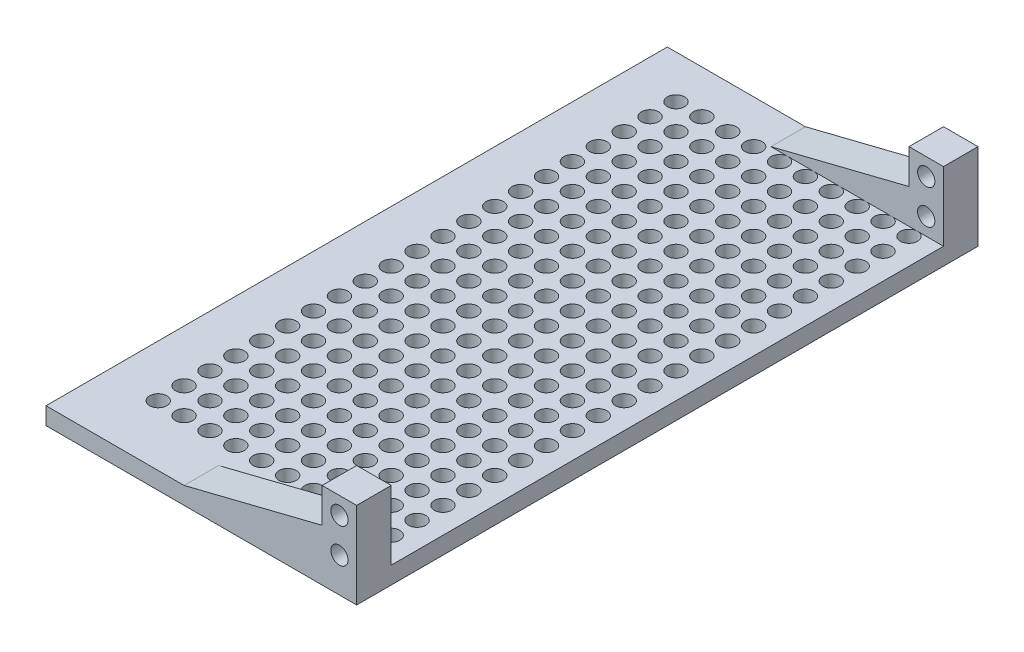
from build123d import *

# Parameters (mm, degrees)
ESQUISSE1_W             = 90
ESQUISSE1_H             = 5
BOSS_EXTRU_1_DEPTH      = 180
ESQUISSE2_W             = 10
ESQUISSE2_H             = 10
BOSS_EXTRU_2_DEPTH      = 20
ESQUISSE3_R             = 2.5
ENL_V_MAT_EXTRU_1_DEPTH = 10
BOSS_EXTRU_3_DEPTH      = 10
ESQUISSE5_R             = 2.5
ENL_V_MAT_EXTRU_2_DEPTH = 5


with BuildPart() as part:
    # Esquisse1 → Boss.-Extru.1 (new body)
    with BuildSketch(Plane.XY):
        Rectangle(ESQUISSE1_W, ESQUISSE1_H)
    extrude(amount=BOSS_EXTRU_1_DEPTH)

    # Esquisse2 → Boss.-Extru.2 (add)
    with BuildSketch(Plane(origin=(0, 2.5, 0), x_dir=(1, 0, 0), z_dir=(0, 1, 0))):
        with Locations((40, -5)):
            Rectangle(ESQUISSE2_W, ESQUISSE2_H)
        with Locations((40, -175)):
            Rectangle(ESQUISSE2_W, ESQUISSE2_H)
    extrude(amount=BOSS_EXTRU_2_DEPTH)

    # Esquisse3 → Enlèv. mat.-Extru.1 (cut)
    with BuildSketch(Plane.XY.offset(180)):
        with Locations((40, 17.5)):
            Circle(ESQUISSE3_R)
        with Locations((40, 7.5)):
            Circle(ESQUISSE3_R)
    enl_v_mat_extru_1 = extrude(amount=-ENL_V_MAT_EXTRU_1_DEPTH, mode=Mode.SUBTRACT)

    # Esquisse4 → Boss.-Extru.3 (add)
    with BuildSketch(Plane.XY.offset(180)):
        Polygon((35, 12.5), (-5, 2.5), (35, 2.5), align=None)
    boss_extru_3 = extrude(amount=-BOSS_EXTRU_3_DEPTH)

    # Symétrie1: Enlèv. mat.-Extru.1, Boss.-Extru.3 across plane
    add(enl_v_mat_extru_1.mirror(Plane.XY.offset(90)), mode=Mode.SUBTRACT)
    add(boss_extru_3.mirror(Plane.XY.offset(90)))

    # Esquisse5 → Enlèv. mat.-Extru.2 (cut)
    with BuildSketch(Plane(origin=(0, 2.5, 0), x_dir=(1, 0, 0), z_dir=(0, 1, 0))):
        with Locations(Location((37.5, -162.5, 0), (0, 0, 270))):
            Circle(ESQUISSE5_R)
        with Locations(Location((30, -162.5, 0), (0, 0, 270))):
            Circle(ESQUISSE5_R)
        with Locations(Location((22.5, -162.5, 0), (0, 0, 270))):
            Circle(ESQUISSE5_R)
        with Locations(Location((15, -162.5, 0), (0, 0, 270))):
            Circle(ESQUISSE5_R)
        with Locations(Location((7.5, -162.5, 0), (0, 0, 270))):
            Circle(ESQUISSE5_R)
        with Locations(Location((0, -162.5, 0), (0, 0, 270))):
            Circle(ESQUISSE5_R)
        with Locations(Location((-7.5, -162.5, 0), (0, 0, 270))):
            Circle(ESQUISSE5_R)
        with Locations(Location((-15, -162.5, 0), (0, 0, 270))):
            Circle(ESQUISSE5_R)
        with Locations(Location((-22.5, -162.5, 0), (0, 0, 270))):
            Circle(ESQUISSE5_R)
        with Locations(Location((-30, -162.5, 0), (0, 0, 270))):
            Circle(ESQUISSE5_R)
        with Locations(Location((30, -155, 0), (0, 0, 270))):
            Circle(ESQUISSE5_R)
        with Locations(Location((22.5, -155, 0), (0, 0, 270))):
            Circle(ESQUISSE5_R)
        with Locations(Location((15, -155, 0), (0, 0, 270))):
            Circle(ESQUISSE5_R)
        with Locations(Location((7.5, -155, 0), (0, 0, 270))):
            Circle(ESQUISSE5_R)
        with Locations(Location((0, -155, 0), (0, 0, 270))):
            Circle(ESQUISSE5_R)
        with Locations(Location((-7.5, -155, 0), (0, 0, 270))):
            Circle(ESQUISSE5_R)
        with Locations(Location((-15, -155, 0), (0, 0, 270))):
            Circle(ESQUISSE5_R)
        with Locations(Location((-22.5, -155, 0), (0, 0, 270))):
            Circle(ESQUISSE5_R)
        with Locations(Location((-30, -155, 0), (0, 0, 270))):
            Circle(ESQUISSE5_R)
        with Locations(Location((30, -147.5, 0), (0, 0, 270))):
            Circle(ESQUISSE5_R)
        with Locations(Location((22.5, -147.5, 0), (0, 0, 270))):
            Circle(ESQUISSE5_R)
        with Locations(Location((15, -147.5, 0), (0, 0, 270))):
            Circle(ESQUISSE5_R)
        with Locations(Location((7.5, -147.5, 0), (0, 0, 270))):
            Circle(ESQUISSE5_R)
        with Locations(Location((0, -147.5, 0), (0, 0, 270))):
            Circle(ESQUISSE5_R)
        with Locations(Location((-7.5, -147.5, 0), (0, 0, 270))):
            Circle(ESQUISSE5_R)
        with Locations(Location((-15, -147.5, 0), (0, 0, 270))):
            Circle(ESQUISSE5_R)
        with Locations(Location((-22.5, -147.5, 0), (0, 0, 270))):
            Circle(ESQUISSE5_R)
        with Locations(Location((-30, -147.5, 0), (0, 0, 270))):
            Circle(ESQUISSE5_R)
        with Locations(Location((30, -140, 0), (0, 0, 270))):
            Circle(ESQUISSE5_R)
        with Locations(Location((22.5, -140, 0), (0, 0, 270))):
            Circle(ESQUISSE5_R)
        with Locations(Location((15, -140, 0), (0, 0, 270))):
            Circle(ESQUISSE5_R)
        with Locations(Location((7.5, -140, 0), (0, 0, 270))):
            Circle(ESQUISSE5_R)
        with Locations(Location((0, -140, 0), (0, 0, 270))):
            Circle(ESQUISSE5_R)
        with Locations(Location((-7.5, -140, 0), (0, 0, 270))):
            Circle(ESQUISSE5_R)
        with Locations(Location((-15, -140, 0), (0, 0, 270))):
            Circle(ESQUISSE5_R)
        with Locations(Location((-22.5, -140, 0), (0, 0, 270))):
            Circle(ESQUISSE5_R)
        with Locations(Location((-30, -140, 0), (0, 0, 270))):
            Circle(ESQUISSE5_R)
        with Locations(Location((30, -132.5, 0), (0, 0, 270))):
            Circle(ESQUISSE5_R)
        with Locations(Location((22.5, -132.5, 0), (0, 0, 270))):
            Circle(ESQUISSE5_R)
        with Locations(Location((15, -132.5, 0), (0, 0, 270))):
            Circle(ESQUISSE5_R)
        with Locations(Location((7.5, -132.5, 0), (0, 0, 270))):
            Circle(ESQUISSE5_R)
        with Locations(Location((0, -132.5, 0), (0, 0, 270))):
            Circle(ESQUISSE5_R)
        with Locations(Location((-7.5, -132.5, 0), (0, 0, 270))):
            Circle(ESQUISSE5_R)
        with Locations(Location((-15, -132.5, 0), (0, 0, 270))):
            Circle(ESQUISSE5_R)
        with Locations(Location((-22.5, -132.5, 0), (0, 0, 270))):
            Circle(ESQUISSE5_R)
        with Locations(Location((-30, -132.5, 0), (0, 0, 270))):
            Circle(ESQUISSE5_R)
        with Locations(Location((30, -125, 0), (0, 0, 270))):
            Circle(ESQUISSE5_R)
        with Locations(Location((22.5, -125, 0), (0, 0, 270))):
            Circle(ESQUISSE5_R)
        with Locations(Location((15, -125, 0), (0, 0, 270))):
            Circle(ESQUISSE5_R)
        with Locations(Location((7.5, -125, 0), (0, 0, 270))):
            Circle(ESQUISSE5_R)
        with Locations(Location((0, -125, 0), (0, 0, 270))):
            Circle(ESQUISSE5_R)
        with Locations(Location((-7.5, -125, 0), (0, 0, 270))):
            Circle(ESQUISSE5_R)
        with Locations(Location((-15, -125, 0), (0, 0, 270))):
            Circle(ESQUISSE5_R)
        with Locations(Location((-22.5, -125, 0), (0, 0, 270))):
            Circle(ESQUISSE5_R)
        with Locations(Location((-30, -125, 0), (0, 0, 270))):
            Circle(ESQUISSE5_R)
        with Locations(Location((30, -117.5, 0), (0, 0, 270))):
            Circle(ESQUISSE5_R)
        with Locations(Location((22.5, -117.5, 0), (0, 0, 270))):
            Circle(ESQUISSE5_R)
        with Locations(Location((15, -117.5, 0), (0, 0, 270))):
            Circle(ESQUISSE5_R)
        with Locations(Location((7.5, -117.5, 0), (0, 0, 270))):
            Circle(ESQUISSE5_R)
        with Locations(Location((0, -117.5, 0), (0, 0, 270))):
            Circle(ESQUISSE5_R)
        with Locations(Location((-7.5, -117.5, 0), (0, 0, 270))):
            Circle(ESQUISSE5_R)
        with Locations(Location((-15, -117.5, 0), (0, 0, 270))):
            Circle(ESQUISSE5_R)
        with Locations(Location((-22.5, -117.5, 0), (0, 0, 270))):
            Circle(ESQUISSE5_R)
        with Locations(Location((-30, -117.5, 0), (0, 0, 270))):
            Circle(ESQUISSE5_R)
        with Locations(Location((30, -110, 0), (0, 0, 270))):
            Circle(ESQUISSE5_R)
        with Locations(Location((22.5, -110, 0), (0, 0, 270))):
            Circle(ESQUISSE5_R)
        with Locations(Location((15, -110, 0), (0, 0, 270))):
            Circle(ESQUISSE5_R)
        with Locations(Location((7.5, -110, 0), (0, 0, 270))):
            Circle(ESQUISSE5_R)
        with Locations(Location((0, -110, 0), (0, 0, 270))):
            Circle(ESQUISSE5_R)
        with Locations(Location((-7.5, -110, 0), (0, 0, 270))):
            Circle(ESQUISSE5_R)
        with Locations(Location((-15, -110, 0), (0, 0, 270))):
            Circle(ESQUISSE5_R)
        with Locations(Location((-22.5, -110, 0), (0, 0, 270))):
            Circle(ESQUISSE5_R)
        with Locations(Location((-30, -110, 0), (0, 0, 270))):
            Circle(ESQUISSE5_R)
        with Locations(Location((30, -102.5, 0), (0, 0, 270))):
            Circle(ESQUISSE5_R)
        with Locations(Location((22.5, -102.5, 0), (0, 0, 270))):
            Circle(ESQUISSE5_R)
        with Locations(Location((15, -102.5, 0), (0, 0, 270))):
            Circle(ESQUISSE5_R)
        with Locations(Location((7.5, -102.5, 0), (0, 0, 270))):
            Circle(ESQUISSE5_R)
        with Locations(Location((0, -102.5, 0), (0, 0, 270))):
            Circle(ESQUISSE5_R)
        with Locations(Location((-7.5, -102.5, 0), (0, 0, 270))):
            Circle(ESQUISSE5_R)
        with Locations(Location((-15, -102.5, 0), (0, 0, 270))):
            Circle(ESQUISSE5_R)
        with Locations(Location((-22.5, -102.5, 0), (0, 0, 270))):
            Circle(ESQUISSE5_R)
        with Locations(Location((-30, -102.5, 0), (0, 0, 270))):
            Circle(ESQUISSE5_R)
        with Locations(Location((30, -95, 0), (0, 0, 270))):
            Circle(ESQUISSE5_R)
        with Locations(Location((22.5, -95, 0), (0, 0, 270))):
            Circle(ESQUISSE5_R)
        with Locations(Location((15, -95, 0), (0, 0, 270))):
            Circle(ESQUISSE5_R)
        with Locations(Location((7.5, -95, 0), (0, 0, 270))):
            Circle(ESQUISSE5_R)
        with Locations(Location((0, -95, 0), (0, 0, 270))):
            Circle(ESQUISSE5_R)
        with Locations(Location((-7.5, -95, 0), (0, 0, 270))):
            Circle(ESQUISSE5_R)
        with Locations(Location((-15, -95, 0), (0, 0, 270))):
            Circle(ESQUISSE5_R)
        with Locations(Location((-22.5, -95, 0), (0, 0, 270))):
            Circle(ESQUISSE5_R)
        with Locations(Location((-30, -95, 0), (0, 0, 270))):
            Circle(ESQUISSE5_R)
        with Locations(Location((30, -87.5, 0), (0, 0, 270))):
            Circle(ESQUISSE5_R)
        with Locations(Location((22.5, -87.5, 0), (0, 0, 270))):
            Circle(ESQUISSE5_R)
        with Locations(Location((15, -87.5, 0), (0, 0, 270))):
            Circle(ESQUISSE5_R)
        with Locations(Location((7.5, -87.5, 0), (0, 0, 270))):
            Circle(ESQUISSE5_R)
        with Locations(Location((0, -87.5, 0), (0, 0, 270))):
            Circle(ESQUISSE5_R)
        with Locations(Location((-7.5, -87.5, 0), (0, 0, 270))):
            Circle(ESQUISSE5_R)
        with Locations(Location((-15, -87.5, 0), (0, 0, 270))):
            Circle(ESQUISSE5_R)
        with Locations(Location((-22.5, -87.5, 0), (0, 0, 270))):
            Circle(ESQUISSE5_R)
        with Locations(Location((-30, -87.5, 0), (0, 0, 270))):
            Circle(ESQUISSE5_R)
        with Locations(Location((30, -80, 0), (0, 0, 270))):
            Circle(ESQUISSE5_R)
        with Locations(Location((22.5, -80, 0), (0, 0, 270))):
            Circle(ESQUISSE5_R)
        with Locations(Location((15, -80, 0), (0, 0, 270))):
            Circle(ESQUISSE5_R)
        with Locations(Location((7.5, -80, 0), (0, 0, 270))):
            Circle(ESQUISSE5_R)
        with Locations(Location((0, -80, 0), (0, 0, 270))):
            Circle(ESQUISSE5_R)
        with Locations(Location((-7.5, -80, 0), (0, 0, 270))):
            Circle(ESQUISSE5_R)
        with Locations(Location((-15, -80, 0), (0, 0, 270))):
            Circle(ESQUISSE5_R)
        with Locations(Location((-22.5, -80, 0), (0, 0, 270))):
            Circle(ESQUISSE5_R)
        with Locations(Location((-30, -80, 0), (0, 0, 270))):
            Circle(ESQUISSE5_R)
        with Locations(Location((30, -72.5, 0), (0, 0, 270))):
            Circle(ESQUISSE5_R)
        with Locations(Location((22.5, -72.5, 0), (0, 0, 270))):
            Circle(ESQUISSE5_R)
        with Locations(Location((15, -72.5, 0), (0, 0, 270))):
            Circle(ESQUISSE5_R)
        with Locations(Location((7.5, -72.5, 0), (0, 0, 270))):
            Circle(ESQUISSE5_R)
        with Locations(Location((0, -72.5, 0), (0, 0, 270))):
            Circle(ESQUISSE5_R)
        with Locations(Location((-7.5, -72.5, 0), (0, 0, 270))):
            Circle(ESQUISSE5_R)
        with Locations(Location((-15, -72.5, 0), (0, 0, 270))):
            Circle(ESQUISSE5_R)
        with Locations(Location((-22.5, -72.5, 0), (0, 0, 270))):
            Circle(ESQUISSE5_R)
        with Locations(Location((-30, -72.5, 0), (0, 0, 270))):
            Circle(ESQUISSE5_R)
        with Locations(Location((30, -65, 0), (0, 0, 270))):
            Circle(ESQUISSE5_R)
        with Locations(Location((22.5, -65, 0), (0, 0, 270))):
            Circle(ESQUISSE5_R)
        with Locations(Location((15, -65, 0), (0, 0, 270))):
            Circle(ESQUISSE5_R)
        with Locations(Location((7.5, -65, 0), (0, 0, 270))):
            Circle(ESQUISSE5_R)
        with Locations(Location((0, -65, 0), (0, 0, 270))):
            Circle(ESQUISSE5_R)
        with Locations(Location((-7.5, -65, 0), (0, 0, 270))):
            Circle(ESQUISSE5_R)
        with Locations(Location((-15, -65, 0), (0, 0, 270))):
            Circle(ESQUISSE5_R)
        with Locations(Location((-22.5, -65, 0), (0, 0, 270))):
            Circle(ESQUISSE5_R)
        with Locations(Location((-30, -65, 0), (0, 0, 270))):
            Circle(ESQUISSE5_R)
        with Locations(Location((30, -57.5, 0), (0, 0, 270))):
            Circle(ESQUISSE5_R)
        with Locations(Location((22.5, -57.5, 0), (0, 0, 270))):
            Circle(ESQUISSE5_R)
        with Locations(Location((15, -57.5, 0), (0, 0, 270))):
            Circle(ESQUISSE5_R)
        with Locations(Location((7.5, -57.5, 0), (0, 0, 270))):
            Circle(ESQUISSE5_R)
        with Locations(Location((0, -57.5, 0), (0, 0, 270))):
            Circle(ESQUISSE5_R)
        with Locations(Location((-7.5, -57.5, 0), (0, 0, 270))):
            Circle(ESQUISSE5_R)
        with Locations(Location((-15, -57.5, 0), (0, 0, 270))):
            Circle(ESQUISSE5_R)
        with Locations(Location((-22.5, -57.5, 0), (0, 0, 270))):
            Circle(ESQUISSE5_R)
        with Locations(Location((-30, -57.5, 0), (0, 0, 270))):
            Circle(ESQUISSE5_R)
        with Locations(Location((30, -50, 0), (0, 0, 270))):
            Circle(ESQUISSE5_R)
        with Locations(Location((22.5, -50, 0), (0, 0, 270))):
            Circle(ESQUISSE5_R)
        with Locations(Location((15, -50, 0), (0, 0, 270))):
            Circle(ESQUISSE5_R)
        with Locations(Location((7.5, -50, 0), (0, 0, 270))):
            Circle(ESQUISSE5_R)
        with Locations(Location((0, -50, 0), (0, 0, 270))):
            Circle(ESQUISSE5_R)
        with Locations(Location((-7.5, -50, 0), (0, 0, 270))):
            Circle(ESQUISSE5_R)
        with Locations(Location((-15, -50, 0), (0, 0, 270))):
            Circle(ESQUISSE5_R)
        with Locations(Location((-22.5, -50, 0), (0, 0, 270))):
            Circle(ESQUISSE5_R)
        with Locations(Location((-30, -50, 0), (0, 0, 270))):
            Circle(ESQUISSE5_R)
        with Locations(Location((30, -42.5, 0), (0, 0, 270))):
            Circle(ESQUISSE5_R)
        with Locations(Location((22.5, -42.5, 0), (0, 0, 270))):
            Circle(ESQUISSE5_R)
        with Locations(Location((15, -42.5, 0), (0, 0, 270))):
            Circle(ESQUISSE5_R)
        with Locations(Location((7.5, -42.5, 0), (0, 0, 270))):
            Circle(ESQUISSE5_R)
        with Locations(Location((0, -42.5, 0), (0, 0, 270))):
            Circle(ESQUISSE5_R)
        with Locations(Location((-7.5, -42.5, 0), (0, 0, 270))):
            Circle(ESQUISSE5_R)
        with Locations(Location((-15, -42.5, 0), (0, 0, 270))):
            Circle(ESQUISSE5_R)
        with Locations(Location((-22.5, -42.5, 0), (0, 0, 270))):
            Circle(ESQUISSE5_R)
        with Locations(Location((-30, -42.5, 0), (0, 0, 270))):
            Circle(ESQUISSE5_R)
        with Locations(Location((30, -35, 0), (0, 0, 270))):
            Circle(ESQUISSE5_R)
        with Locations(Location((22.5, -35, 0), (0, 0, 270))):
            Circle(ESQUISSE5_R)
        with Locations(Location((15, -35, 0), (0, 0, 270))):
            Circle(ESQUISSE5_R)
        with Locations(Location((7.5, -35, 0), (0, 0, 270))):
            Circle(ESQUISSE5_R)
        with Locations(Location((0, -35, 0), (0, 0, 270))):
            Circle(ESQUISSE5_R)
        with Locations(Location((-7.5, -35, 0), (0, 0, 270))):
            Circle(ESQUISSE5_R)
        with Locations(Location((-15, -35, 0), (0, 0, 270))):
            Circle(ESQUISSE5_R)
        with Locations(Location((-22.5, -35, 0), (0, 0, 270))):
            Circle(ESQUISSE5_R)
        with Locations(Location((-30, -35, 0), (0, 0, 270))):
            Circle(ESQUISSE5_R)
        with Locations(Location((30, -27.5, 0), (0, 0, 270))):
            Circle(ESQUISSE5_R)
        with Locations(Location((22.5, -27.5, 0), (0, 0, 270))):
            Circle(ESQUISSE5_R)
        with Locations(Location((15, -27.5, 0), (0, 0, 270))):
            Circle(ESQUISSE5_R)
        with Locations(Location((7.5, -27.5, 0), (0, 0, 270))):
            Circle(ESQUISSE5_R)
        with Locations(Location((0, -27.5, 0), (0, 0, 270))):
            Circle(ESQUISSE5_R)
        with Locations(Location((-7.5, -27.5, 0), (0, 0, 270))):
            Circle(ESQUISSE5_R)
        with Locations(Location((-15, -27.5, 0), (0, 0, 270))):
            Circle(ESQUISSE5_R)
        with Locations(Location((-22.5, -27.5, 0), (0, 0, 270))):
            Circle(ESQUISSE5_R)
        with Locations(Location((-30, -27.5, 0), (0, 0, 270))):
            Circle(ESQUISSE5_R)
        with Locations(Location((30, -20, 0), (0, 0, 270))):
            Circle(ESQUISSE5_R)
        with Locations(Location((22.5, -20, 0), (0, 0, 270))):
            Circle(ESQUISSE5_R)
        with Locations(Location((15, -20, 0), (0, 0, 270))):
            Circle(ESQUISSE5_R)
        with Locations(Location((7.5, -20, 0), (0, 0, 270))):
            Circle(ESQUISSE5_R)
        with Locations(Location((0, -20, 0), (0, 0, 270))):
            Circle(ESQUISSE5_R)
        with Locations(Location((-7.5, -20, 0), (0, 0, 270))):
            Circle(ESQUISSE5_R)
        with Locations(Location((-15, -20, 0), (0, 0, 270))):
            Circle(ESQUISSE5_R)
        with Locations(Location((-22.5, -20, 0), (0, 0, 270))):
            Circle(ESQUISSE5_R)
        with Locations(Location((-30, -20, 0), (0, 0, 270))):
            Circle(ESQUISSE5_R)
        with Locations(Location((30, -12.5, 0), (0, 0, 270))):
            Circle(ESQUISSE5_R)
        with Locations(Location((22.5, -12.5, 0), (0, 0, 270))):
            Circle(ESQUISSE5_R)
        with Locations(Location((15, -12.5, 0), (0, 0, 270))):
            Circle(ESQUISSE5_R)
        with Locations(Location((7.5, -12.5, 0), (0, 0, 270))):
            Circle(ESQUISSE5_R)
        with Locations(Location((0, -12.5, 0), (0, 0, 270))):
            Circle(ESQUISSE5_R)
        with Locations(Location((-7.5, -12.5, 0), (0, 0, 270))):
            Circle(ESQUISSE5_R)
        with Locations(Location((-15, -12.5, 0), (0, 0, 270))):
            Circle(ESQUISSE5_R)
        with Locations(Location((-22.5, -12.5, 0), (0, 0, 270))):
            Circle(ESQUISSE5_R)
        with Locations(Location((-30, -12.5, 0), (0, 0, 270))):
            Circle(ESQUISSE5_R)
        with Locations(Location((37.5, -155, 0), (0, 0, 270))):
            Circle(ESQUISSE5_R)
        with Locations(Location((37.5, -147.5, 0), (0, 0, 270))):
            Circle(ESQUISSE5_R)
        with Locations(Location((37.5, -140, 0), (0, 0, 270))):
            Circle(ESQUISSE5_R)
        with Locations(Location((37.5, -132.5, 0), (0, 0, 270))):
            Circle(ESQUISSE5_R)
        with Locations(Location((37.5, -125, 0), (0, 0, 270))):
            Circle(ESQUISSE5_R)
        with Locations(Location((37.5, -117.5, 0), (0, 0, 270))):
            Circle(ESQUISSE5_R)
        with Locations(Location((37.5, -110, 0), (0, 0, 270))):
            Circle(ESQUISSE5_R)
        with Locations(Location((37.5, -102.5, 0), (0, 0, 270))):
            Circle(ESQUISSE5_R)
        with Locations(Location((37.5, -95, 0), (0, 0, 270))):
            Circle(ESQUISSE5_R)
        with Locations(Location((37.5, -87.5, 0), (0, 0, 270))):
            Circle(ESQUISSE5_R)
        with Locations(Location((37.5, -80, 0), (0, 0, 270))):
            Circle(ESQUISSE5_R)
        with Locations(Location((37.5, -72.5, 0), (0, 0, 270))):
            Circle(ESQUISSE5_R)
        with Locations(Location((37.5, -65, 0), (0, 0, 270))):
            Circle(ESQUISSE5_R)
        with Locations(Location((37.5, -57.5, 0), (0, 0, 270))):
            Circle(ESQUISSE5_R)
        with Locations(Location((37.5, -50, 0), (0, 0, 270))):
            Circle(ESQUISSE5_R)
        with Locations(Location((37.5, -42.5, 0), (0, 0, 270))):
            Circle(ESQUISSE5_R)
        with Locations(Location((37.5, -35, 0), (0, 0, 270))):
            Circle(ESQUISSE5_R)
        with Locations(Location((37.5, -27.5, 0), (0, 0, 270))):
            Circle(ESQUISSE5_R)
        with Locations(Location((37.5, -20, 0), (0, 0, 270))):
            Circle(ESQUISSE5_R)
        with Locations(Location((37.5, -12.5, 0), (0, 0, 270))):
            Circle(ESQUISSE5_R)
    extrude(amount=-ENL_V_MAT_EXTRU_2_DEPTH, mode=Mode.SUBTRACT)


solid = part.part
